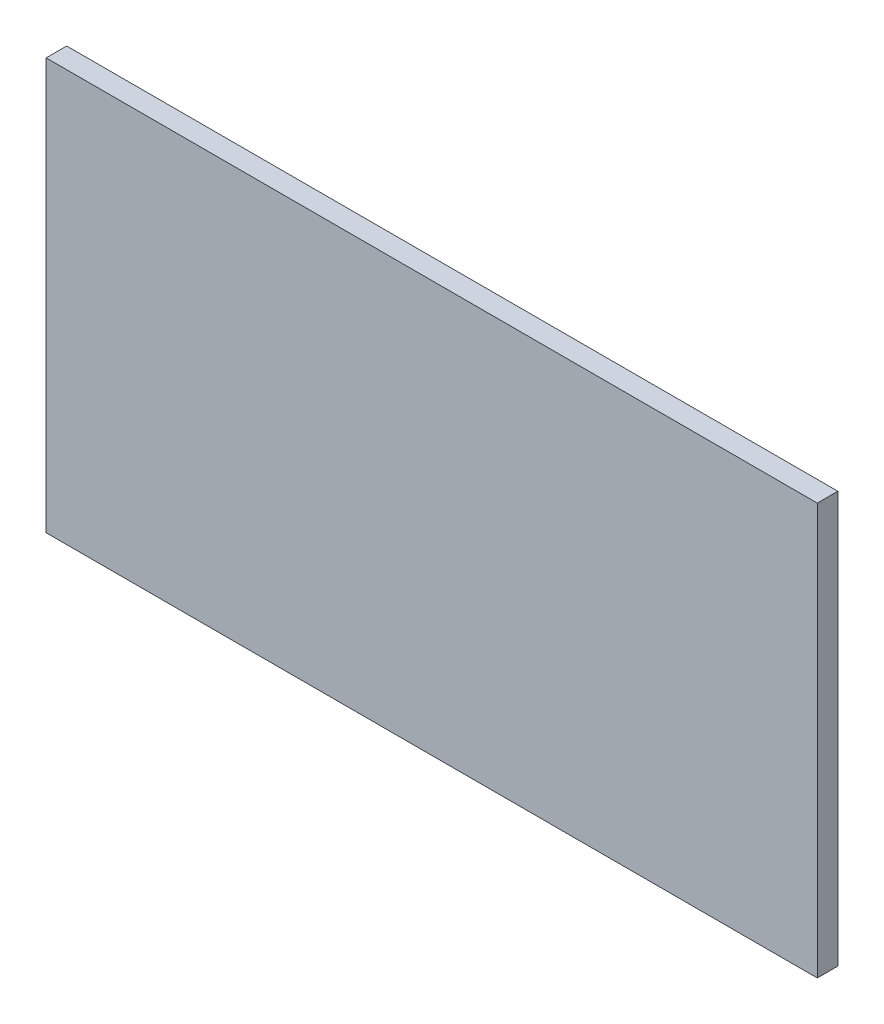
from build123d import *

# Parameters (mm, degrees)
SKETCH1_W           = 4
SKETCH1_H           = 80
BOSS_EXTRUDE1_DEPTH = 75


with BuildPart() as part:
    # Sketch1 → Boss-Extrude1 (new, symmetric)
    with BuildSketch(Plane(origin=(0, 0, 0), x_dir=(0, 0, -1), z_dir=(1, 0, 0))):
        Rectangle(SKETCH1_W, SKETCH1_H)
    extrude(amount=BOSS_EXTRUDE1_DEPTH, both=True)


solid = part.part
